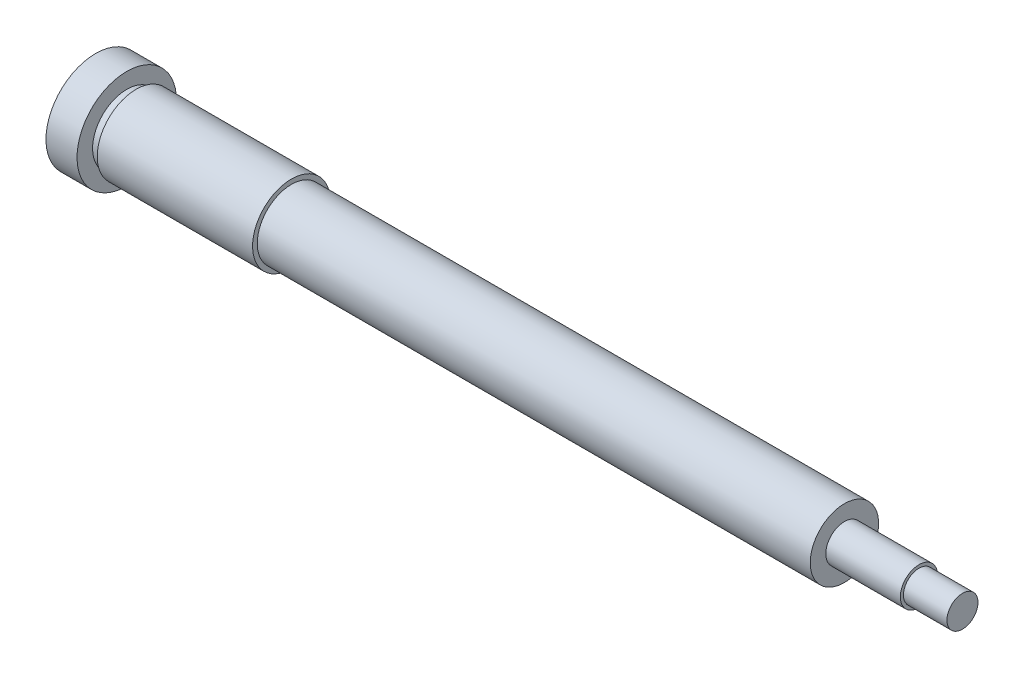
from build123d import *


with BuildPart() as part:
    # Schizzo1 → Rivoluzione1 (revolve)
    with BuildSketch(Plane.XY):
        Polygon((-279, 0), (-279, 16), (-269, 16), (-269, 11), (-266, 11), (-266, 12.5), (-216, 12.5), (-216, 11), (-38, 11), (-38, 6), (-14, 6), (-14, 5), (0, 5), (0, 0), align=None)
    revolve(axis=Axis((0, 0, 0), (-1, 0, 0)))


solid = part.part
